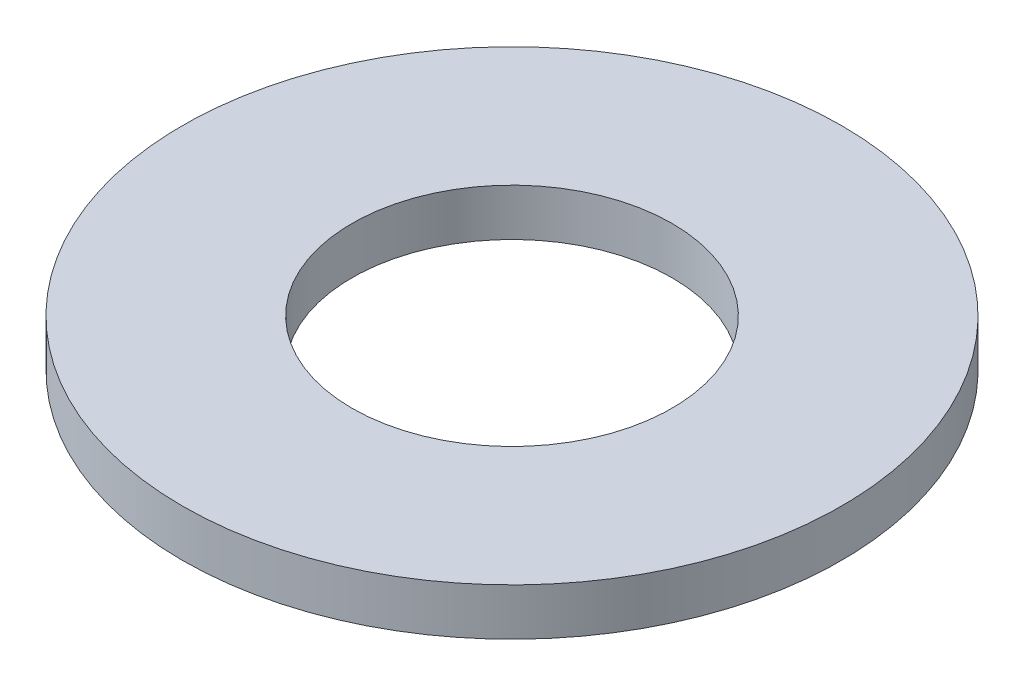
from build123d import *

# Parameters (mm, degrees)
SKETCH_1_W = 1.8
SKETCH_1_H = 0.5


with BuildPart() as part:
    # 草图1 → Revolve 475 (revolve)
    with BuildSketch(Plane.XY, mode=Mode.PRIVATE) as revolve_475_sk:
        with Locations((-2.6, 8.894507042)):
            Rectangle(SKETCH_1_W, SKETCH_1_H)
    revolve(revolve_475_sk.sketch.rotate(Axis((0, 0, 0), (0, 1, 0)), 270), axis=Axis((0, 0, 0), (0, 1, 0)))


solid = part.part
